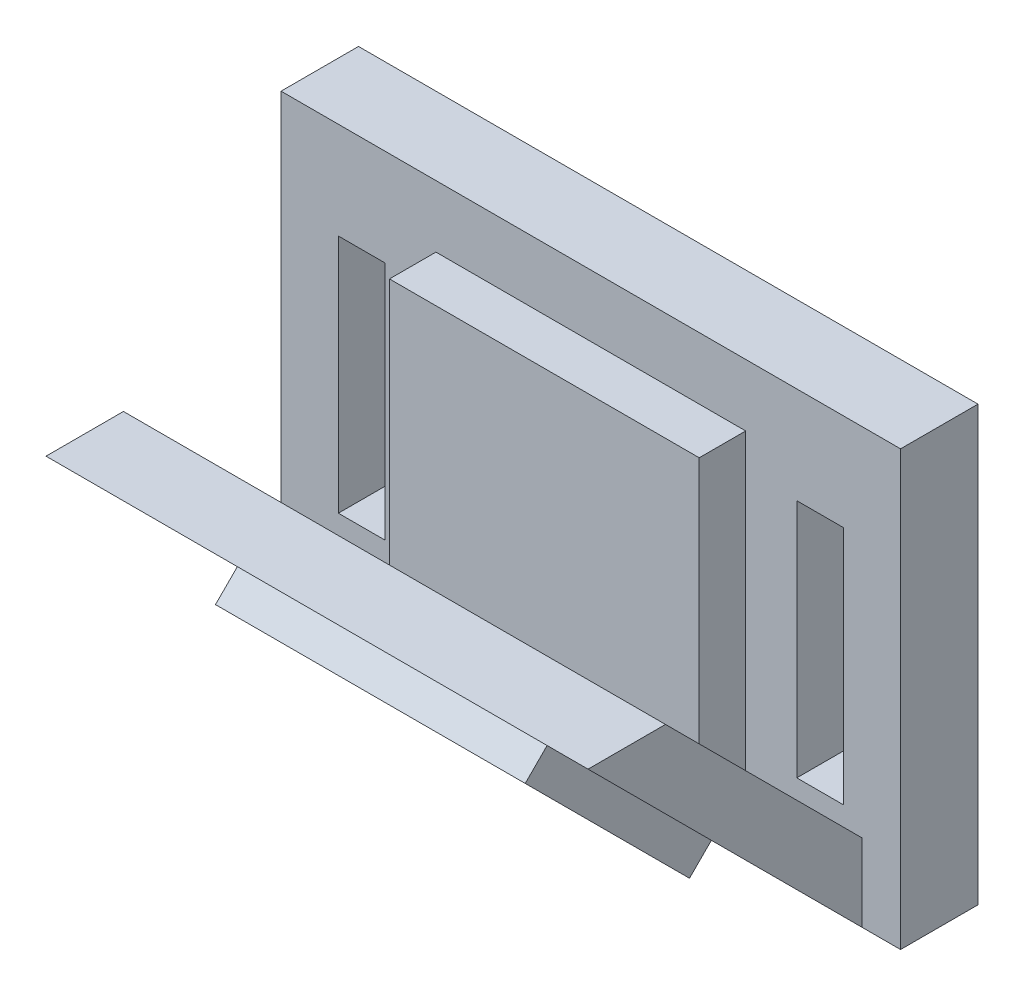
from build123d import *

# Parameters (mm, degrees)
CROQUIS1_W              = 40
CROQUIS1_H              = 28
CROQUIS1_W_2            = 3
CROQUIS1_H_2            = 15.5
SALIENTE_EXTRUIR1_DEPTH = 2.5
CROQUIS2_W              = 20
CROQUIS2_H              = 20
SALIENTE_EXTRUIR2_DEPTH = 3
SALIENTE_EXTRUIR3_DEPTH = 17.5
CROQUIS4_W              = 20
CROQUIS4_H              = 15
SALIENTE_EXTRUIR4_DEPTH = 2


with BuildPart() as part:
    # Croquis1 → Saliente-Extruir1 (new, symmetric)
    with BuildSketch(Plane.XY):
        Rectangle(CROQUIS1_W, CROQUIS1_H)
        with Locations((14.8, 0)):
            Rectangle(CROQUIS1_W_2, CROQUIS1_H_2, mode=Mode.SUBTRACT)
        with Locations((-14.8, 0)):
            Rectangle(CROQUIS1_W_2, CROQUIS1_H_2, mode=Mode.SUBTRACT)
    extrude(amount=SALIENTE_EXTRUIR1_DEPTH, both=True)

    # Croquis2 → Saliente-Extruir2 (add)
    with BuildSketch(Plane.XY.offset(2.5)):
        Rectangle(CROQUIS2_W, CROQUIS2_H)
    extrude(amount=SALIENTE_EXTRUIR2_DEPTH)

    # Croquis3 → Saliente-Extruir3 (add, symmetric)
    with BuildSketch(Plane(origin=(0, 0, 0), x_dir=(0, 0, -1), z_dir=(1, 0, 0))):
        Polygon((-2.5, -14), (-20.17766953, 3.67766953), (-15.17766953, 3.67766953), (-2.5, -9), align=None)
    extrude(amount=SALIENTE_EXTRUIR3_DEPTH, both=True)

    # Croquis4 → Saliente-Extruir4 (add)
    with BuildSketch(Plane(origin=(0, -8.25, 8.25), x_dir=(1, 0, 0), z_dir=(0, -0.7071067811865441, 0.707106781186551))):
        with Locations((0, 2.5)):
            Rectangle(CROQUIS4_W, CROQUIS4_H)
    extrude(amount=SALIENTE_EXTRUIR4_DEPTH)


solid = part.part
